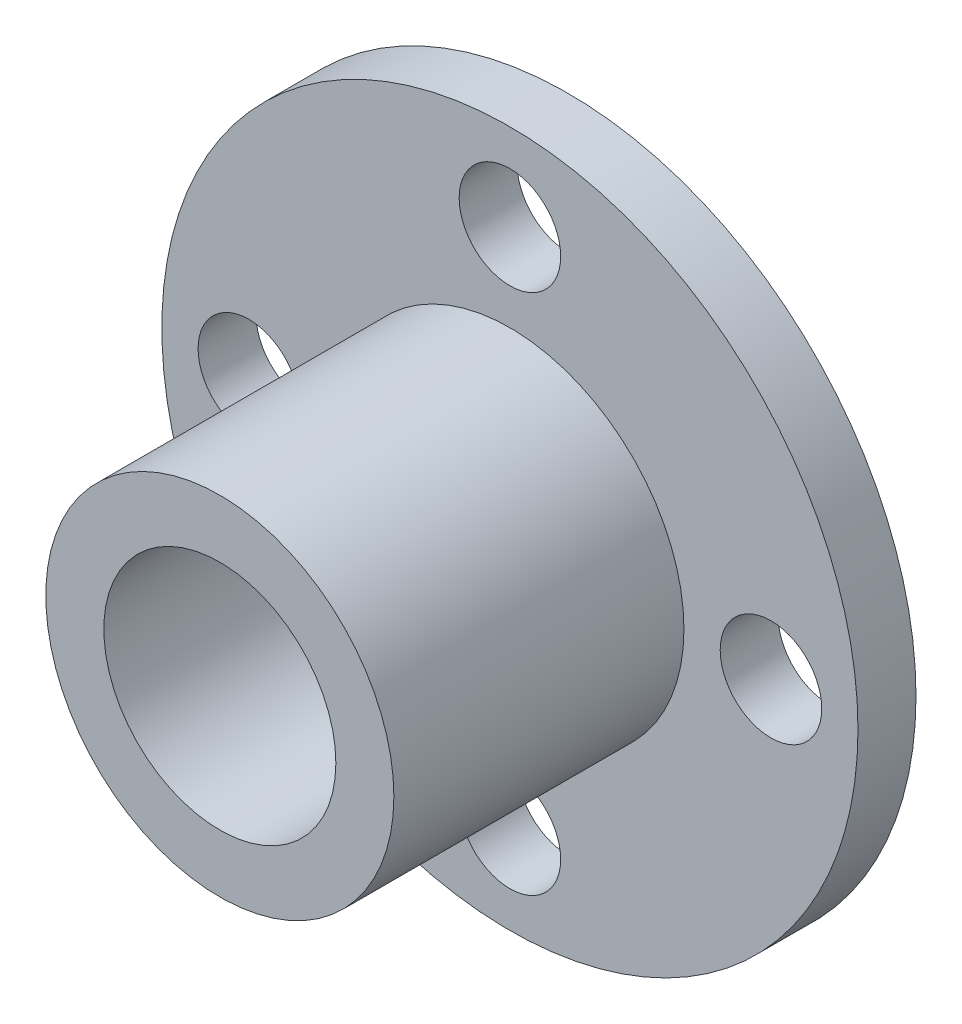
from build123d import *

# Parameters (mm, degrees)
SKETCH_1_R          = 12
SKETCH_1_R_2        = 4
EXTRUDE_1_DEPTH     = 2
SKETCH_2_R          = 6
SKETCH_2_R_2        = 4
EXTRUDE_3_DEPTH     = 10
SKETCH_4_R          = 1.75
CUT_EXTRUDE_1_DEPTH = 16.7


with BuildPart() as part:
    # 草图1 → 凸台-拉伸1 (new body)
    with BuildSketch(Plane.XY):
        Circle(SKETCH_1_R)
        Circle(SKETCH_1_R_2, mode=Mode.SUBTRACT)
    extrude(amount=EXTRUDE_1_DEPTH)

    # 草图2 → 凸台-拉伸3 (add)
    with BuildSketch(Plane.XY.offset(2)):
        Circle(SKETCH_2_R)
        Circle(SKETCH_2_R_2, mode=Mode.SUBTRACT)
    extrude(amount=EXTRUDE_3_DEPTH)

    # 草图4 → 切除-拉伸1 (cut)
    with BuildSketch(Plane(origin=(0, 0, 0), x_dir=(-1, 0, 0), z_dir=(0, 0, -1))):
        with Locations((9, 0)):
            Circle(SKETCH_4_R)
        with Locations((0, 9)):
            Circle(SKETCH_4_R)
        with Locations((-9, 0)):
            Circle(SKETCH_4_R)
        with Locations((0, -9)):
            Circle(SKETCH_4_R)
    extrude(amount=-CUT_EXTRUDE_1_DEPTH, mode=Mode.SUBTRACT)


solid = part.part
